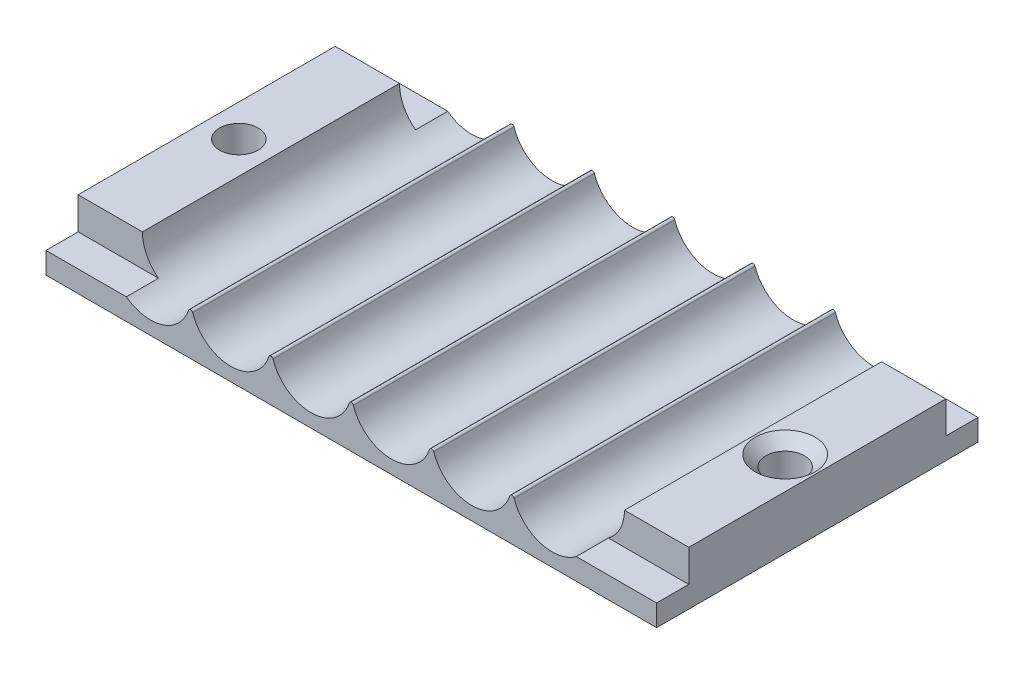
from build123d import *

# Parameters (mm, degrees)
RESSALTO_EXTRUS_O1_DEPTH = 15
ESBO_O2_R                = 1.8
CORTE_EXTRUS_O1_DEPTH    = 33.592176975
ESBO_O3_W                = 9.75
ESBO_O3_H                = 3
CORTE_EXTRUS_O2_DEPTH    = 3
FILETE1_R                = 0.2
CHANFRO1_SIZE            = 1


with BuildPart() as part:
    # Esboço1 → Ressalto-extrusão1 (new, symmetric)
    with BuildSketch(Plane.XY):
        with BuildLine():
            Line((-22.5, 0), (22.5, 0))
            Line((22.5, 0), (28.5, 0))
            Line((28.5, 0), (28.5, 5))
            Line((28.5, 5), (22.5, 5))
            ThreePointArc((22.5, 5), (18.75, 1.25), (15, 5))
            ThreePointArc((15, 5), (11.25, 1.25), (7.5, 5))
            ThreePointArc((7.5, 5), (3.75, 1.25), (0, 5))
            ThreePointArc((0, 5), (-3.75, 1.25), (-7.5, 5))
            ThreePointArc((-7.5, 5), (-11.25, 1.25), (-15, 5))
            ThreePointArc((-15, 5), (-18.75, 1.25), (-22.5, 5))
            Line((-22.5, 5), (-28.5, 5))
            Line((-28.5, 5), (-28.5, 0))
            Line((-28.5, 0), (-22.5, 0))
        make_face()
    extrude(amount=RESSALTO_EXTRUS_O1_DEPTH, both=True)

    # Esboço2 → Corte-extrusão1 (cut, through all)
    with BuildSketch(Plane(origin=(0, 5, 0), x_dir=(1, 0, 0), z_dir=(0, 1, 0))):
        with Locations(Location((-25.5, 0, 0), (0, 0, 180))):
            Circle(ESBO_O2_R)
        with Locations((25.5, 0)):
            Circle(ESBO_O2_R)
    extrude(amount=-CORTE_EXTRUS_O1_DEPTH, mode=Mode.SUBTRACT)

    # Esboço3 → Corte-extrusão2 (cut)
    with BuildSketch(Plane(origin=(0, 5, 0), x_dir=(1, 0, 0), z_dir=(0, 1, 0))):
        with Locations((-23.625, 13.5)):
            Rectangle(ESBO_O3_W, ESBO_O3_H)
        with Locations((-23.625, -13.5)):
            Rectangle(ESBO_O3_W, ESBO_O3_H)
        with Locations((23.625, -13.5)):
            Rectangle(ESBO_O3_W, ESBO_O3_H)
        with Locations((23.625, 13.5)):
            Rectangle(ESBO_O3_W, ESBO_O3_H)
    extrude(amount=-CORTE_EXTRUS_O2_DEPTH, mode=Mode.SUBTRACT)

    # Filete1
    filete1_edges = [part.edges().sort_by_distance(p)[0] for p in [
        (-15, 5, 0),
        (-7.5, 5, 0),
        (0, 5, 0),
        (7.5, 5, 0),
        (15, 5, 0),
    ]]
    fillet(filete1_edges, radius=FILETE1_R)

    # Chanfro1
    chanfro1_edges = [part.edges().sort_by_distance(p)[0] for p in [
        (-23.7, 0, 0),
        (23.7, 0, 0),
        (23.7, 5, 0),
    ]]
    chamfer(chanfro1_edges, length=CHANFRO1_SIZE)


solid = part.part
